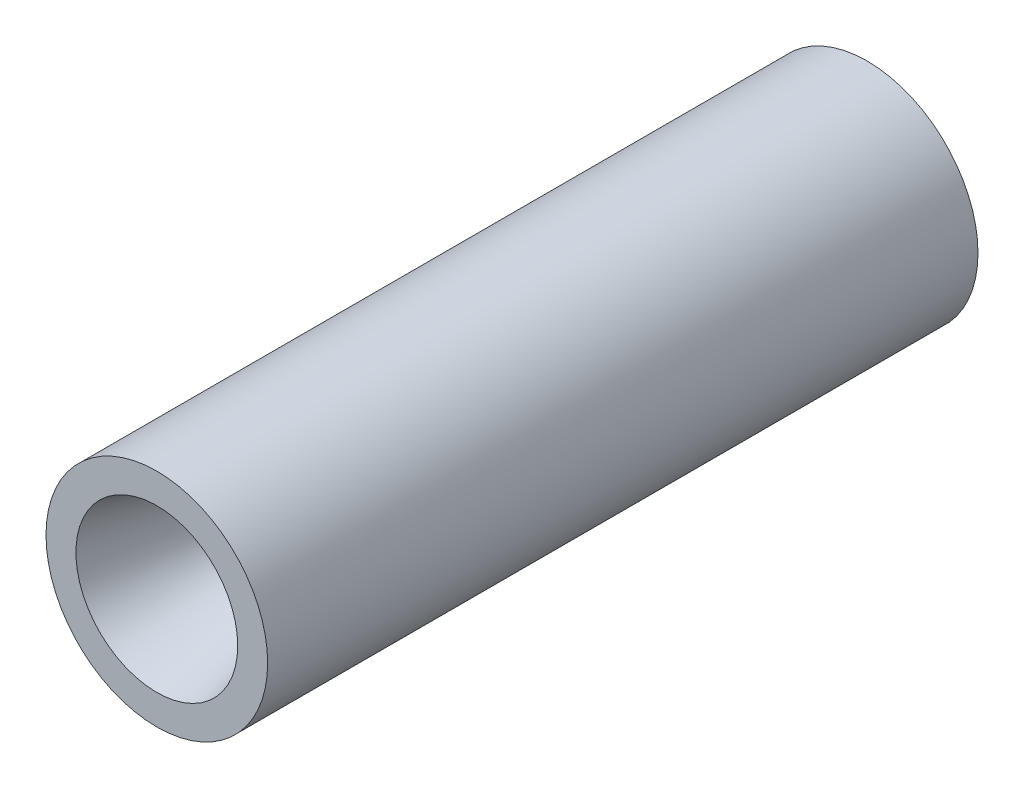
from build123d import *

# Parameters (mm, degrees)
SKETCH1_R           = 25.4
BOSS_EXTRUDE1_DEPTH = 81.407
SKETCH2_R           = 3.81
CUT_EXTRUDE2_DEPTH  = 167.729477286


with BuildPart() as part:
    # Sketch1 → Boss-Extrude1 (new, symmetric)
    with BuildSketch(Plane.XY):
        Circle(SKETCH1_R)
    extrude(amount=BOSS_EXTRUDE1_DEPTH, both=True)

    # Sketch2 → Cut-Extrude2 (cut, through all)
    with BuildSketch(Plane.XY.offset(81.407)):
        Circle(SKETCH2_R)
    extrude(amount=-CUT_EXTRUDE2_DEPTH, mode=Mode.SUBTRACT)

    # Sketch6 → Cut-Revolve1 (revolve, cut)
    with BuildSketch(Plane(origin=(0, 0, 0), x_dir=(0, 0, -1), z_dir=(1, 0, 0)), mode=Mode.PRIVATE) as cut_revolve1_sk:
        Polygon((-12.207313926, 0), (-81.407, 18.542), (-81.407, 0), align=None)
    revolve(cut_revolve1_sk.sketch.rotate(Axis((0, 0, -89.5477), (0, 0, 1)), 270), axis=Axis((0, 0, -89.5477), (0, 0, 1)), mode=Mode.SUBTRACT)


solid = part.part
